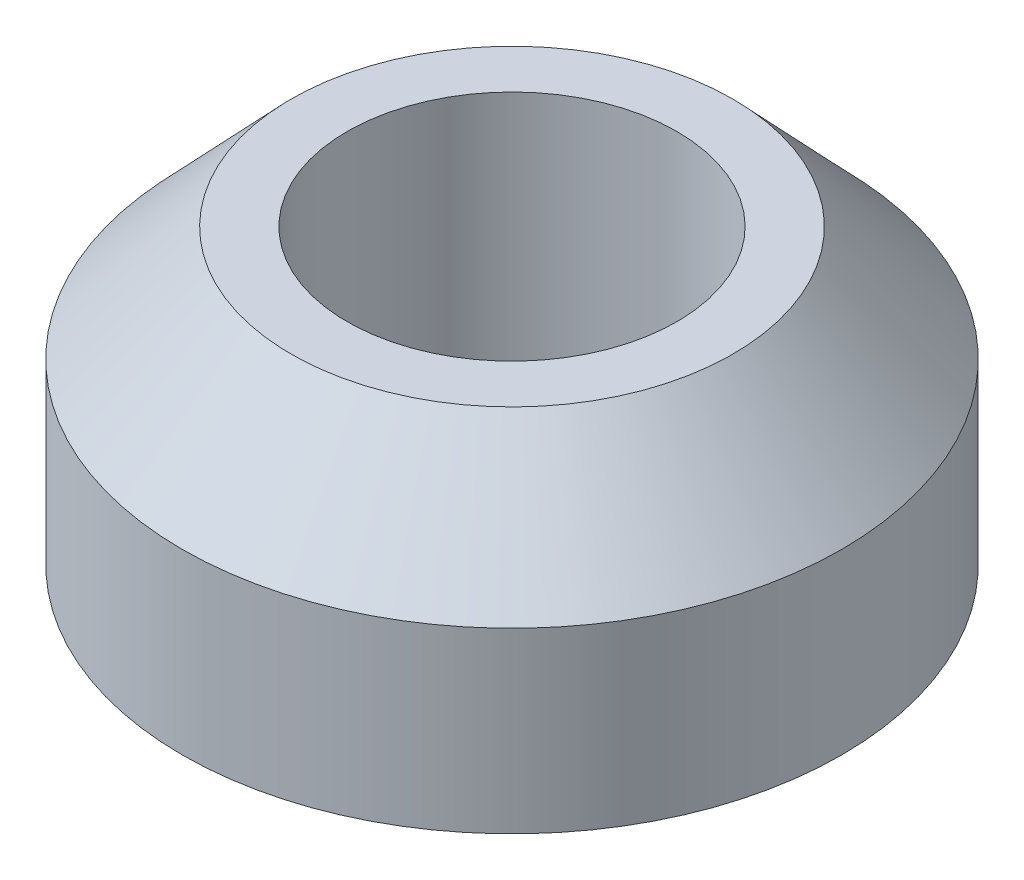
from build123d import *


with BuildPart() as part:
    # Sketch2 → Revolve1 (revolve)
    with BuildSketch(Plane(origin=(0, 0, 0), x_dir=(0, 0, -1), z_dir=(1, 0, 0))):
        Polygon((3.175, 0), (3.175, 5.6388), (4.2545, 5.6388), (6.35, 3.429), (6.35, 0), align=None)
    revolve(axis=Axis((0, 0, 0), (0, 1, 0)))


solid = part.part
